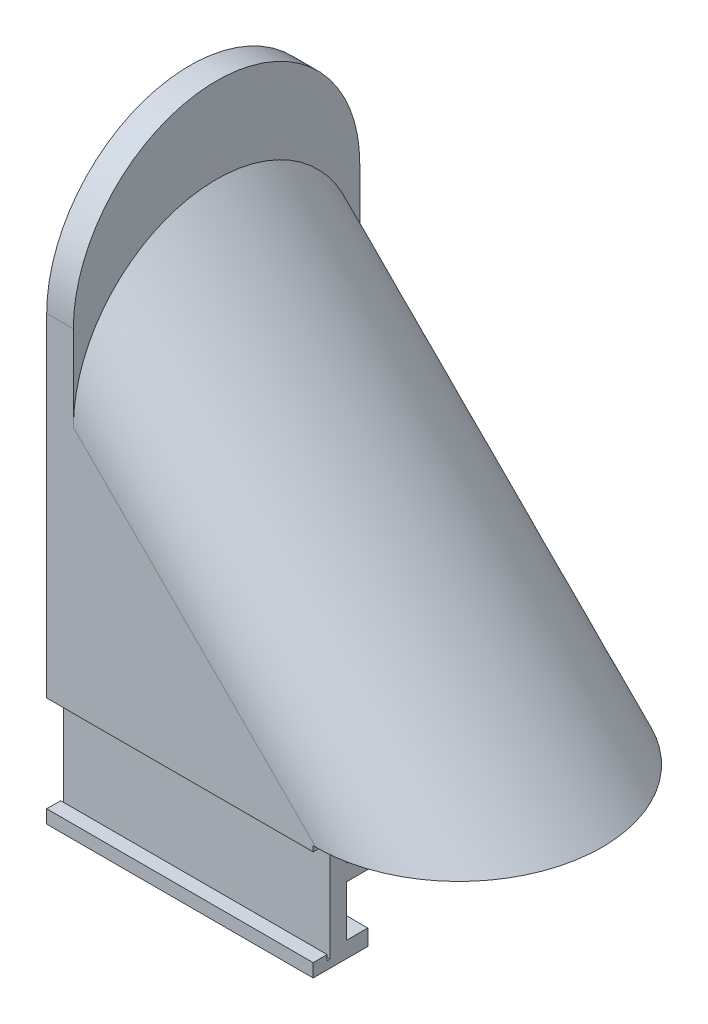
from build123d import *

# Parameters (mm, degrees)
SKETCH3_W           = 22.864276312
SKETCH3_H           = 28.163711354
CUT_EXTRUDE1_DEPTH  = 24.243278598
BOSS_EXTRUDE1_DEPTH = 1
SKETCH6_W           = 10.001476891
SKETCH6_H           = 0.625
BOSS_EXTRUDE2_DEPTH = 3.6
SKETCH7_W           = 10.001476891
SKETCH7_H           = 1.25
BOSS_EXTRUDE3_DEPTH = 0.5
BOSS_EXTRUDE4_DEPTH = 0.6
SKETCH9_W           = 10.001476891
SKETCH9_H           = 0.1
CUT_EXTRUDE2_DEPTH  = 4
CUT_EXTRUDE3_DEPTH  = 0.2
SKETCH12_W          = 10.001476891
SKETCH12_H          = 0.8
BOSS_EXTRUDE5_DEPTH = 0.6


with BuildPart() as part:
    # Sweep1: sweep along a path in Sketch2
    with BuildLine(Plane.XY) as sweep1_path:
        Line((0, 0), (-15, 15))
    # Sketch1 → Sweep1 (sweep)
    with BuildSketch(Plane(origin=(0, 0, 0), x_dir=(1, 0, 0), z_dir=(0, 1, 0))):
        with BuildLine():
            Line((0, 0), (9.3, 0))
            ThreePointArc((9.3, 0), (13.425, 4.125), (9.3, 8.25))
            Line((9.3, 8.25), (0, 8.25))
            Line((0, 8.25), (0, 9.5))
            Line((0, 9.5), (9.3, 9.5))
            ThreePointArc((9.3, 9.5), (14.675, 4.125), (9.3, -1.25))
            Line((9.3, -1.25), (0, -1.25))
            Line((0, -1.25), (0, 0))
        make_face()
    sweep(path=sweep1_path.line)

    # Sketch3 → Cut-Extrude1 (cut, through all)
    with BuildSketch(Plane(origin=(0, 0, 0), x_dir=(0, 0, -1), z_dir=(-1, 0, 0))):
        with Locations((2.794700938, -13.471268798)):
            Rectangle(SKETCH3_W, SKETCH3_H)
    extrude(amount=CUT_EXTRUDE1_DEPTH, mode=Mode.SUBTRACT)

    # Sketch5 → Boss-Extrude1 (add)
    with BuildSketch(Plane(origin=(0, 0, 0), x_dir=(0, 0, -1), z_dir=(-1, 0, 0))):
        with BuildLine():
            Line((9.5, 0), (9.5, -12.5))
            ThreePointArc((9.5, -12.5), (4.125, -17.875), (-1.25, -12.5))
            Line((-1.25, -12.5), (-1.25, 0))
            Line((-1.25, 0), (0, 0))
            Line((0, 0), (0, -9.3))
            ThreePointArc((0, -9.3), (4.125, -13.425), (8.25, -9.3))
            Line((8.25, -9.3), (8.25, 0))
            Line((8.25, 0), (9.5, 0))
        make_face()
    extrude(amount=BOSS_EXTRUDE1_DEPTH)

    # Sketch6 → Boss-Extrude2 (add)
    with BuildSketch(Plane.XZ):
        with Locations((4.000738446, -8.5625)):
            Rectangle(SKETCH6_W, SKETCH6_H)
        with Locations((4.000738446, 0.3125)):
            Rectangle(SKETCH6_W, SKETCH6_H)
    extrude(amount=BOSS_EXTRUDE2_DEPTH)

    # Sketch7 → Boss-Extrude3 (add)
    with BuildSketch(Plane.XZ.offset(3.6)):
        with Locations((4.000738446, 0.625)):
            Rectangle(SKETCH7_W, SKETCH7_H)
        with Locations((4.000738446, -8.875)):
            Rectangle(SKETCH7_W, SKETCH7_H)
    extrude(amount=BOSS_EXTRUDE3_DEPTH)

    # Sketch8 → Boss-Extrude4 (add)
    with BuildSketch(Plane(origin=(0, -1, 0), x_dir=(-1, 0, 0), z_dir=(0, -1, 0))):
        Polygon((-9.001476891, 8.25), (-9.001476891, 0), (-3.501476891, 0), (1, 0), (1, 0.8), (-3.501476891, 0.8), (-3.501476891, 2.875), (1, 2.875), (1, 5.375), (-3.501476891, 5.375), (-3.501476891, 7.45), (1, 7.45), (1, 8.25), (-3.501476891, 8.25), align=None)
    extrude(amount=BOSS_EXTRUDE4_DEPTH)

    # Sketch9 → Cut-Extrude2 (cut)
    with BuildSketch(Plane(origin=(0, 0.2, 0), x_dir=(-1, 0, 0), z_dir=(0, -1, 0))):
        with Locations((-4.000738446, -0.675)):
            Rectangle(SKETCH9_W, SKETCH9_H)
        with Locations((-4.000738446, 8.925)):
            Rectangle(SKETCH9_W, SKETCH9_H)
    extrude(amount=CUT_EXTRUDE2_DEPTH, mode=Mode.SUBTRACT)

    # Sketch10 → Cut-Extrude3 (cut)
    with BuildSketch(Plane.XZ):
        Polygon((9.001476891, 0.725), (9.001476891, -8.875), (9.001476891, -10.300951844), (15.96659325, -10.300951844), (15.96659325, 1.743519047), (9.001476891, 1.743519047), align=None)
    extrude(amount=-CUT_EXTRUDE3_DEPTH, mode=Mode.SUBTRACT)

    # Sketch12 → Boss-Extrude5 (add)
    with BuildSketch(Plane.XZ.offset(4.1)):
        with Locations((4.000738446, -7.85)):
            Rectangle(SKETCH12_W, SKETCH12_H)
        with Locations((4.000738446, -0.4)):
            Rectangle(SKETCH12_W, SKETCH12_H)
    extrude(amount=-BOSS_EXTRUDE5_DEPTH)


solid = part.part
